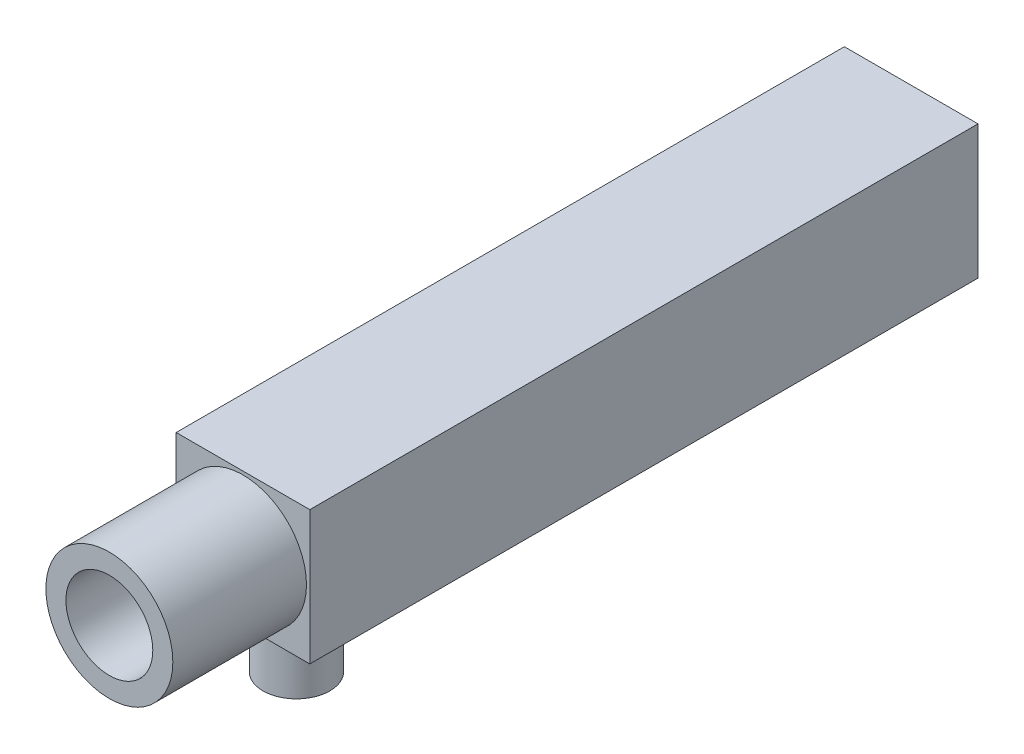
from build123d import *

# Parameters (mm, degrees)
SKETCH1_W           = 10
SKETCH1_H           = 10
SKETCH1_W_2         = 7
SKETCH1_H_2         = 7
BOSS_EXTRUDE1_DEPTH = 50
SKETCH2_W           = 7
SKETCH2_H           = 7
BOSS_EXTRUDE2_DEPTH = 5
SKETCH3_R           = 4
CUT_EXTRUDE1_DEPTH  = 5
SKETCH4_R           = 2.5
SKETCH4_R_2         = 0.5
BOSS_EXTRUDE3_DEPTH = 5
SKETCH5_R           = 4.75
SKETCH5_R_2         = 3.25
BOSS_EXTRUDE4_DEPTH = 10


with BuildPart() as part:
    # Sketch1 → Boss-Extrude1 (new body)
    with BuildSketch(Plane.XY):
        with Locations((-5, 5)):
            Rectangle(SKETCH1_W, SKETCH1_H)
        with Locations((-5, 5)):
            Rectangle(SKETCH1_W_2, SKETCH1_H_2, mode=Mode.SUBTRACT)
    extrude(amount=BOSS_EXTRUDE1_DEPTH)

    # Sketch2 → Boss-Extrude2 (add)
    with BuildSketch(Plane.XY.offset(50)):
        with Locations((-5, 5)):
            Rectangle(SKETCH2_W, SKETCH2_H)
    extrude(amount=-BOSS_EXTRUDE2_DEPTH)

    # Sketch3 → Cut-Extrude1 (cut)
    with BuildSketch(Plane.XY.offset(50)):
        with Locations((-5, 5)):
            Circle(SKETCH3_R)
    extrude(amount=-CUT_EXTRUDE1_DEPTH, mode=Mode.SUBTRACT)

    # Sketch4 → Boss-Extrude3 (add)
    with BuildSketch(Plane.XZ):
        with Locations(Location((-5, 46, 0), (0, 0, 180))):
            Circle(SKETCH4_R)
        with Locations((-5, 46)):
            Circle(SKETCH4_R_2, mode=Mode.SUBTRACT)
    extrude(amount=BOSS_EXTRUDE3_DEPTH)

    # Sketch5 → Boss-Extrude4 (add)
    with BuildSketch(Plane.XY.offset(50)):
        with Locations((-5, 5)):
            Circle(SKETCH5_R)
        with Locations((-5, 5)):
            Circle(SKETCH5_R_2, mode=Mode.SUBTRACT)
    extrude(amount=BOSS_EXTRUDE4_DEPTH)


solid = part.part
